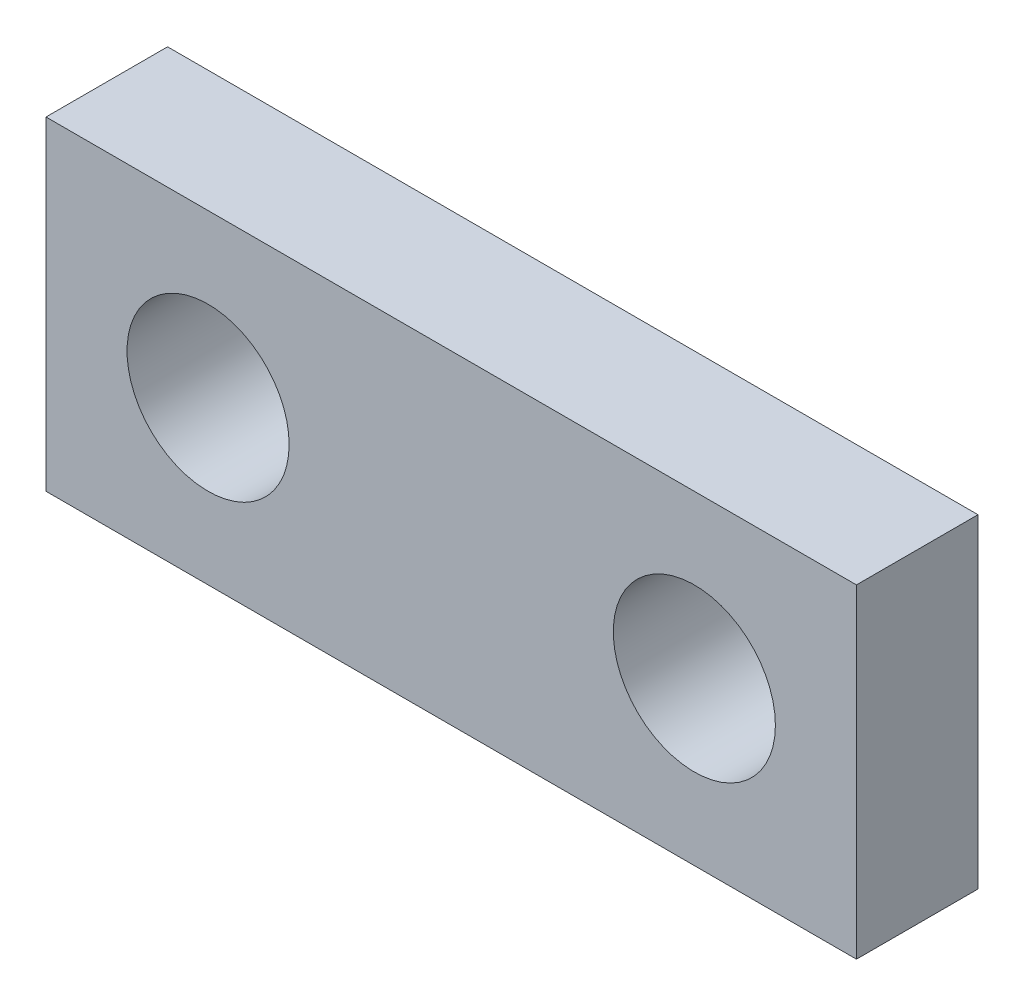
from build123d import *

# Parameters (mm, degrees)
CROQUIS1_W              = 20
CROQUIS1_H              = 8
CROQUIS1_R              = 2
SALIENTE_EXTRUIR1_DEPTH = 3


with BuildPart() as part:
    # Croquis1 → Saliente-Extruir1 (new body)
    with BuildSketch(Plane.XY):
        Rectangle(CROQUIS1_W, CROQUIS1_H)
        with Locations((6, 0)):
            Circle(CROQUIS1_R, mode=Mode.SUBTRACT)
        with Locations((-6, 0)):
            Circle(CROQUIS1_R, mode=Mode.SUBTRACT)
    extrude(amount=SALIENTE_EXTRUIR1_DEPTH)


solid = part.part
